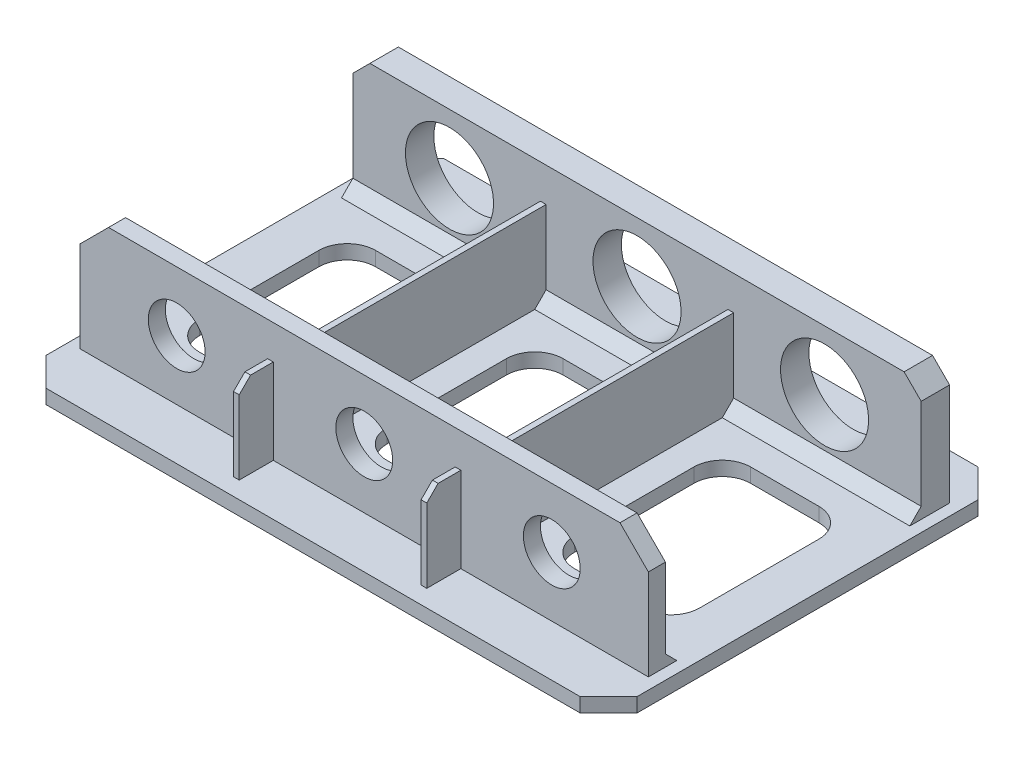
from build123d import *

# Parameters (mm, degrees)
SKETCH1_W           = 100
SKETCH1_H           = 70
BOSS_EXTRUDE1_DEPTH = 2.5
SKETCH2_W           = 100
SKETCH2_H           = 5
SKETCH2_H_2         = 3
BOSS_EXTRUDE2_DEPTH = 21
SKETCH3_R           = 7.75
CUT_EXTRUDE1_DEPTH  = 61
BOSS_EXTRUDE3_START = -3
SKETCH4_R           = 7.75
SKETCH4_R_2         = 5
BOSS_EXTRUDE3_DEPTH = 3
SKETCH5_W           = 70
SKETCH5_H           = 2.5
BOSS_EXTRUDE4_DEPTH = 2
SKETCH6_W           = 70
SKETCH6_H           = 2.5
BOSS_EXTRUDE5_DEPTH = 2
CHAMFER1_SIZE       = 5
SKETCH9_W           = 1
SKETCH9_H           = 64
BOSS_EXTRUDE8_DEPTH = 15
CHAMFER3_SIZE       = 2
CHAMFER4_SIZE       = 3
CHAMFER5_SIZE       = 2
SKETCH11_W          = 22
SKETCH11_H          = 31
CUT_EXTRUDE2_DEPTH  = 10
FILLET1_R           = 5


with BuildPart() as part:
    # Sketch1 → Boss-Extrude1 (new body)
    with BuildSketch(Plane(origin=(0, 0, 0), x_dir=(1, 0, 0), z_dir=(0, 1, 0))):
        Rectangle(SKETCH1_W, SKETCH1_H)
    extrude(amount=BOSS_EXTRUDE1_DEPTH)

    # Sketch2 → Boss-Extrude2 (add)
    with BuildSketch(Plane(origin=(0, 2.5, 0), x_dir=(1, 0, 0), z_dir=(0, 1, 0))):
        with Locations((0, 24.5)):
            Rectangle(SKETCH2_W, SKETCH2_H)
        with Locations((0, -24.5)):
            Rectangle(SKETCH2_W, SKETCH2_H_2)
    extrude(amount=BOSS_EXTRUDE2_DEPTH)

    # Sketch3 → Cut-Extrude1 (cut)
    with BuildSketch(Plane(origin=(0, 0, -27), x_dir=(-1, 0, 0), z_dir=(0, 0, -1))):
        with Locations((-33, 13)):
            Circle(SKETCH3_R)
        with Locations((0, 13)):
            Circle(SKETCH3_R)
        with Locations((33, 13)):
            Circle(SKETCH3_R)
    extrude(amount=-CUT_EXTRUDE1_DEPTH, mode=Mode.SUBTRACT)

    # Sketch4 → Boss-Extrude3 (add)
    # profile 1 of 3: a face of its own
    with BuildSketch(Plane.XY.offset(26).offset(BOSS_EXTRUDE3_START)):
        with Locations(Location((-33, 13, 0), (0, 0, 180))):
            Circle(SKETCH4_R)
        with Locations((-33, 13)):
            Circle(SKETCH4_R_2, mode=Mode.SUBTRACT)
    # profile 2 of 3: a face of its own
    with BuildSketch(Plane.XY.offset(26).offset(BOSS_EXTRUDE3_START)):
        with Locations(Location((0, 13, 0), (0, 0, 180))):
            Circle(SKETCH4_R)
        with Locations((0, 13)):
            Circle(SKETCH4_R_2, mode=Mode.SUBTRACT)
    # profile 3 of 3: a face of its own
    with BuildSketch(Plane.XY.offset(26).offset(BOSS_EXTRUDE3_START)):
        with Locations(Location((33, 13, 0), (0, 0, 180))):
            Circle(SKETCH4_R)
        with Locations((33, 13)):
            Circle(SKETCH4_R_2, mode=Mode.SUBTRACT)
    extrude(amount=BOSS_EXTRUDE3_DEPTH)

    # Sketch5 → Boss-Extrude4 (add)
    with BuildSketch(Plane.ZY.offset(50)):
        with Locations((0, 1.25)):
            Rectangle(SKETCH5_W, SKETCH5_H)
    extrude(amount=BOSS_EXTRUDE4_DEPTH)

    # Sketch6 → Boss-Extrude5 (add)
    with BuildSketch(Plane(origin=(50, 0, 0), x_dir=(0, 0, -1), z_dir=(1, 0, 0))):
        with Locations((0, 1.25)):
            Rectangle(SKETCH6_W, SKETCH6_H)
    extrude(amount=BOSS_EXTRUDE5_DEPTH)

    # Chamfer1
    chamfer1_edges = [part.edges().sort_by_distance(p)[0] for p in [
        (52, 1.25, -35),
        (52, 1.25, 35),
        (-50, 23.5, 24.5),
        (50, 23.5, 24.5),
        (-52, 1.25, -35),
        (-52, 1.25, 35),
    ]]
    chamfer(chamfer1_edges, length=CHAMFER1_SIZE)

    # Sketch9 → Boss-Extrude8 (add)
    with BuildSketch(Plane(origin=(0, 2.5, 0), x_dir=(1, 0, 0), z_dir=(0, 1, 0))):
        with Locations((-16.5, 0)):
            Rectangle(SKETCH9_W, SKETCH9_H)
        with Locations((16.5, 0)):
            Rectangle(SKETCH9_W, SKETCH9_H)
    extrude(amount=BOSS_EXTRUDE8_DEPTH)

    # Chamfer3
    chamfer3_edges = [part.edges().sort_by_distance(p)[0] for p in [
        (-16.5, 17.5, -32),
        (-16.5, 17.5, 32),
        (16.5, 17.5, -32),
        (16.5, 17.5, 32),
    ]]
    chamfer(chamfer3_edges, length=CHAMFER3_SIZE)

    # Chamfer4
    chamfer4_edges = [part.edges().sort_by_distance(p)[0] for p in [
        (-50, 23.5, -24.5),
        (50, 23.5, -24.5),
    ]]
    chamfer(chamfer4_edges, length=CHAMFER4_SIZE)

    # Chamfer5
    chamfer5_edges = [part.edges().sort_by_distance(p)[0] for p in [
        (-33.5, 2.5, -22),
        (-33.5, 2.5, 23),
        (0, 2.5, -22),
        (0, 2.5, 23),
        (33.5, 2.5, -22),
        (33.5, 2.5, 23),
    ]]
    chamfer(chamfer5_edges, length=CHAMFER5_SIZE)

    # Sketch11 → Cut-Extrude2 (cut)
    with BuildSketch(Plane(origin=(0, 2.5, 0), x_dir=(1, 0, 0), z_dir=(0, 1, 0))):
        with Locations((0, -0.5)):
            Rectangle(SKETCH11_W, SKETCH11_H)
        with Locations((-33, -0.5)):
            Rectangle(SKETCH11_W, SKETCH11_H)
        with Locations((33, -0.5)):
            Rectangle(SKETCH11_W, SKETCH11_H)
    extrude(amount=-CUT_EXTRUDE2_DEPTH, mode=Mode.SUBTRACT)

    # Fillet1
    fillet1_edges = [part.edges().sort_by_distance(p)[0] for p in [
        (-11, 1.25, 16),
        (-11, 1.25, -15),
        (11, 1.25, -15),
        (11, 1.25, 16),
        (-22, 1.25, -15),
        (-22, 1.25, 16),
        (-44, 1.25, 16),
        (-44, 1.25, -15),
        (22, 1.25, 16),
        (22, 1.25, -15),
        (44, 1.25, -15),
        (44, 1.25, 16),
    ]]
    fillet(fillet1_edges, radius=FILLET1_R)


solid = part.part
